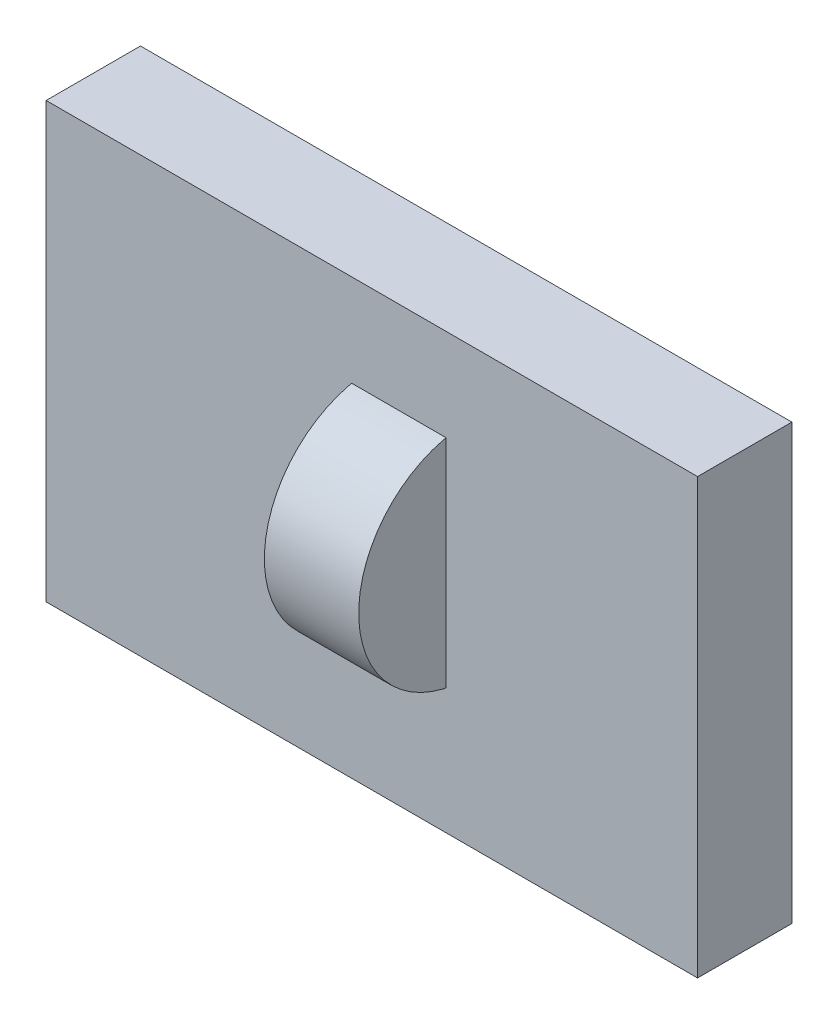
from build123d import *

# Parameters (mm, degrees)
SKETCH_1_W      = 69.064774026
SKETCH_1_H      = 46.043182684
EXTRUDE_1_DEPTH = 10
SKETCH_2_R      = 11.767350743
EXTRUDE_3_DEPTH = 10


with BuildPart() as part:
    # Эскиз1 → Бобышка-Вытянуть1 (new body)
    with BuildSketch(Plane.XY):
        with Locations((2.12506997, -1.770891642)):
            Rectangle(SKETCH_1_W, SKETCH_1_H)
    extrude(amount=-EXTRUDE_1_DEPTH)


with BuildPart() as body_2:
    # Эскиз2 → Бобышка-Вытянуть3 (new body)
    with BuildSketch(Plane(origin=(0, 0, 0), x_dir=(0, 0, -1), z_dir=(1, 0, 0))):
        with Locations((-19.75002894, 0)):
            Circle(SKETCH_2_R)
    extrude(amount=EXTRUDE_3_DEPTH)


with BuildPart() as body_2_1:
    # Move Body 1: moved
    add(body_2.part.moved(Location((0, 0, -22.247799759))))


solid = Compound([part.part, body_2_1.part])
